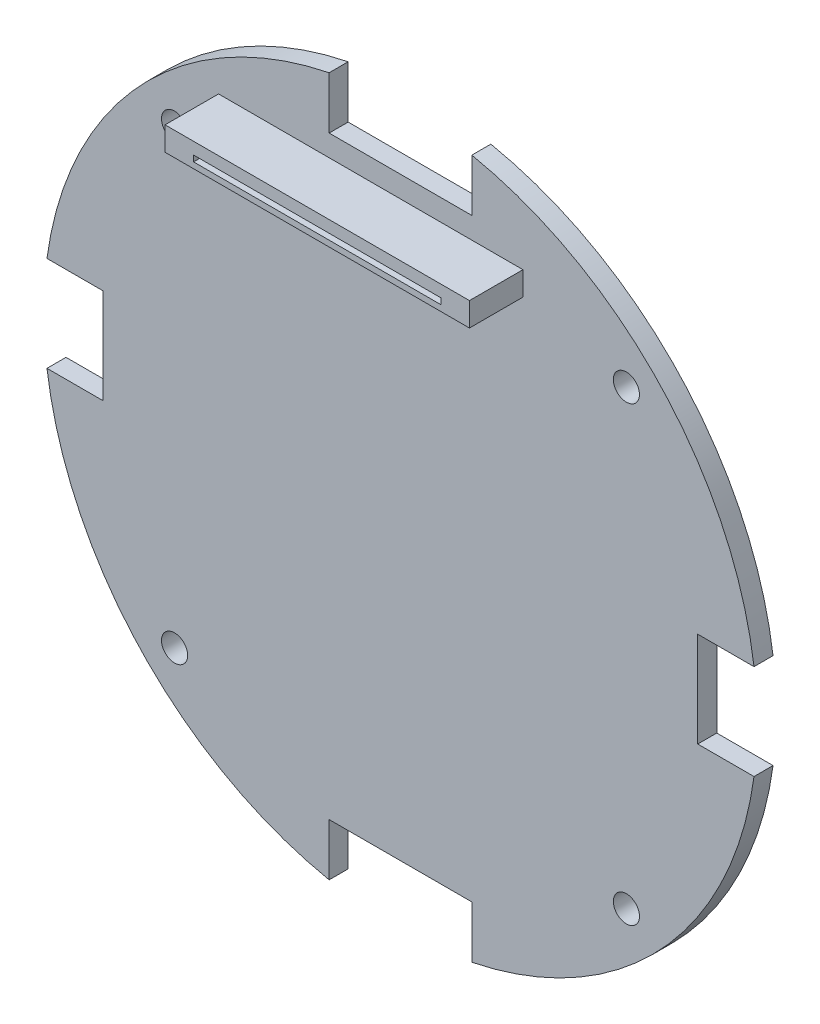
from build123d import *

# Parameters (mm, degrees)
BOSS_EXTRUDE1_DEPTH = 1.6
SKETCH2_R           = 1.1
CUT_EXTRUDE1_DEPTH  = 42.839694072
SKETCH3_W           = 25.6
SKETCH3_H           = 2
BOSS_EXTRUDE2_DEPTH = 4.5
SKETCH4_W           = 20.8
SKETCH4_H           = 0.5
CUT_EXTRUDE2_DEPTH  = 2
SKETCH5_W           = 3.7
SKETCH5_H           = 17.2
SKETCH5_H_2         = 16.7
BOSS_EXTRUDE3_DEPTH = 4.5


with BuildPart() as part:
    # Sketch1 → Boss-Extrude1 (new body)
    with BuildSketch(Plane.XY):
        with BuildLine():
            Line((-6, 29.393876913), (-6, 25))
            Line((-6, 25), (6, 25))
            Line((6, 25), (6, 29.393876913))
            ThreePointArc((6, 29.393876913), (21.918226631, 20.483928855), (29.732137495, 4))
            Line((29.732137495, 4), (25, 4))
            Line((25, 4), (25, -4))
            Line((25, -4), (29.732137495, -4))
            ThreePointArc((29.732137495, -4), (21.918226631, -20.483928855), (6, -29.393876913))
            Line((6, -29.393876913), (6, -25))
            Line((6, -25), (-6, -25))
            Line((-6, -25), (-6, -29.393876913))
            ThreePointArc((-6, -29.393876913), (-21.918226631, -20.483928855), (-29.732137495, -4))
            Line((-29.732137495, -4), (-25, -4))
            Line((-25, -4), (-25, 4))
            Line((-25, 4), (-29.732137495, 4))
            ThreePointArc((-29.732137495, 4), (-21.918226631, 20.483928855), (-6, 29.393876913))
        make_face()
    extrude(amount=BOSS_EXTRUDE1_DEPTH)

    # Sketch2 → Cut-Extrude1 (cut, through all)
    with BuildSketch(Plane.XY):
        with Locations((-19, 19)):
            Circle(SKETCH2_R)
        with Locations((19, 19)):
            Circle(SKETCH2_R)
        with Locations((19, -19)):
            Circle(SKETCH2_R)
        with Locations((-19, -19)):
            Circle(SKETCH2_R)
    extrude(amount=CUT_EXTRUDE1_DEPTH, mode=Mode.SUBTRACT)

    # Sketch3 → Boss-Extrude2 (add)
    with BuildSketch(Plane.XY.offset(1.6)):
        with Locations((-2.5, 22.2)):
            Rectangle(SKETCH3_W, SKETCH3_H)
    extrude(amount=BOSS_EXTRUDE2_DEPTH)

    # Sketch4 → Cut-Extrude2 (cut)
    with BuildSketch(Plane.XY.offset(6.1)):
        with Locations((-2.5, 21.95)):
            Rectangle(SKETCH4_W, SKETCH4_H)
    extrude(amount=-CUT_EXTRUDE2_DEPTH, mode=Mode.SUBTRACT)

    # Sketch5 → Boss-Extrude3 (add)
    with BuildSketch(Plane(origin=(0, 0, 0), x_dir=(-1, 0, 0), z_dir=(0, 0, -1))):
        with Locations((-6.75, -3.81)):
            Rectangle(SKETCH5_W, SKETCH5_H)
        with Locations((3.94, -15.24)):
            Rectangle(SKETCH5_W, SKETCH5_H_2)
    extrude(amount=BOSS_EXTRUDE3_DEPTH)


solid = part.part
